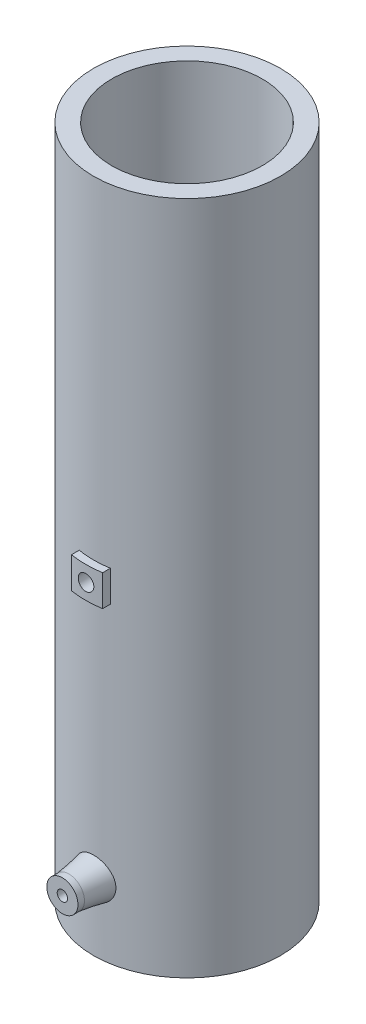
from build123d import *

# Parameters (mm, degrees)
SKETCH1_R                = 18
SKETCH1_R_2              = 14.5
BOSS_EXTRUDE1_DEPTH      = 130
FILLET1_R                = 3
BOSS_EXTRUDE2_DEPTH      = 6
SKETCH4_R                = 1.5
CUT_EXTRUDE1_DEPTH       = 1.5
BOSS_EXTRUDE3_DEPTH      = 6
BOSS_EXTRUDE3_DEPTH_BACK = 1
SKETCH5_R                = 3
SKETCH7_R                = 1
CUT_EXTRUDE2_DEPTH       = 6
SKETCH8_R                = 14.5
SKETCH8_R_2              = 11.5
BOSS_EXTRUDE4_DEPTH      = 10
FILLET2_R                = 2


with BuildPart() as part:
    # Sketch1 → Boss-Extrude1 (new body)
    with BuildSketch(Plane(origin=(0, 0, 0), x_dir=(1, 0, 0), z_dir=(0, 1, 0))):
        Circle(SKETCH1_R)
        Circle(SKETCH1_R_2, mode=Mode.SUBTRACT)
    extrude(amount=BOSS_EXTRUDE1_DEPTH)

    # Fillet1
    fillet1_edges = [part.edges().sort_by_distance(p)[0] for p in [
        (-14.5, 0, 0),
    ]]
    fillet(fillet1_edges, radius=FILLET1_R)

    # Sketch3 → Boss-Extrude2 (add)
    with BuildSketch(Plane(origin=(0, 60, 0), x_dir=(1, 0, 0), z_dir=(0, 1, 0))):
        with BuildLine():
            Line((-3, -19.267848868), (-3, -17.748239349))
            ThreePointArc((-3, -17.748239349), (0, -18), (3, -17.748239349))
            Line((3, -17.748239349), (3, -19.267848868))
            ThreePointArc((3, -19.267848868), (0, -19.5), (-3, -19.267848868))
        make_face()
        with BuildLine():
            Line((3, 19.267848868), (3, 17.748239349))
            ThreePointArc((3, 17.748239349), (0, 18), (-3, 17.748239349))
            Line((-3, 17.748239349), (-3, 19.267848868))
            ThreePointArc((-3, 19.267848868), (0, 19.5), (3, 19.267848868))
        make_face()
    extrude(amount=BOSS_EXTRUDE2_DEPTH)

    # Sketch4 → Cut-Extrude1 (cut, symmetric)
    with BuildSketch(Plane.XY.offset(18)):
        with Locations((0, 63)):
            Circle(SKETCH4_R)
    cut_extrude1 = extrude(amount=CUT_EXTRUDE1_DEPTH, both=True, mode=Mode.SUBTRACT)

    # Mirror1: Cut-Extrude1 across plane
    add(cut_extrude1.mirror(Plane.XY), mode=Mode.SUBTRACT)



with BuildPart() as body_2:
    # Sketch5 → Boss-Extrude3 (new, two sides: drawn at the far end of the back side and taken through both)
    with BuildSketch(Plane.XY.offset(18).offset(-BOSS_EXTRUDE3_DEPTH_BACK)):
        with Locations((0, 13)):
            Circle(SKETCH5_R)
    extrude(amount=BOSS_EXTRUDE3_DEPTH + BOSS_EXTRUDE3_DEPTH_BACK)


with BuildPart() as part_1:
    add(part.part)

    add(body_2.part)  # Revolve1 merges body 2
    # Sketch6 → Revolve1 (revolve)
    with BuildSketch(Plane(origin=(0, 0, 0), x_dir=(0, 0, -1), z_dir=(1, 0, 0))):
        with BuildLine():
            Line((-22.744590516, 16), (-22.744590516, 13))
            Line((-22.744590516, 13), (-16.500678741, 13))
            Line((-16.500678741, 13), (-16.500678741, 17.154644063))
            add(Edge.make_bspline(
                [(-16.500678741, 17.154644063), (-18.548555394, 16.616818558), (-20.629859319, 16.231937203), (-22.744590516, 16)],
                knots=[0.47611858, 0.47611858, 0.47611858, 0.47611858, 1, 1, 1, 1], degree=3))
        make_face()
    revolve(axis=Axis((0, 13, 22.744590516), (0, 0, -1)))

    # Sketch7 → Cut-Extrude2 (cut)
    with BuildSketch(Plane.XY.offset(24)):
        with Locations((0, 13)):
            Circle(SKETCH7_R)
    extrude(amount=-CUT_EXTRUDE2_DEPTH, mode=Mode.SUBTRACT)

    # Sketch8 → Boss-Extrude4 (add)
    with BuildSketch(Plane(origin=(0, 70, 0), x_dir=(1, 0, 0), z_dir=(0, 1, 0))):
        Circle(SKETCH8_R)
        Circle(SKETCH8_R_2, mode=Mode.SUBTRACT)
    extrude(amount=BOSS_EXTRUDE4_DEPTH)

    # Fillet2
    fillet2_edges = [part_1.edges().sort_by_distance(p)[0] for p in [
        (-14.5, 80, 0),
    ]]
    fillet(fillet2_edges, radius=FILLET2_R)


solid = part_1.part
